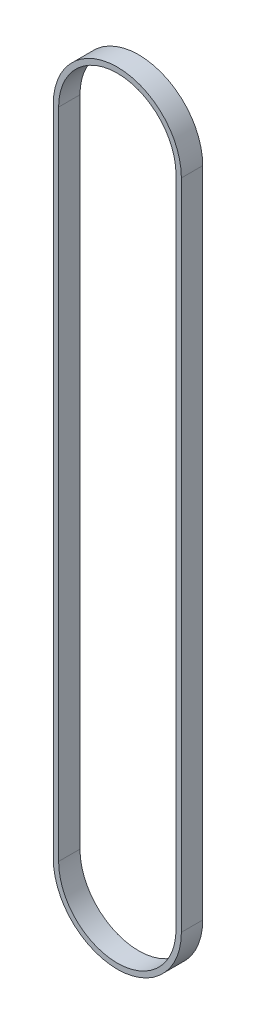
from build123d import *

# Parameters (mm, degrees)
BOSS_EXTRUDE1_DEPTH = 25.4


with BuildPart() as part:
    # Sketch1 → Boss-Extrude1 (new body)
    with BuildSketch(Plane.XY):
        with BuildLine():
            Line((-76.2, -366.489291397), (-76.2, 410.750708603))
            ThreePointArc((-76.2, 410.750708603), (0, 486.950708603), (76.2, 410.750708603))
            Line((76.2, 410.750708603), (76.2, -366.489291397))
            ThreePointArc((76.2, -366.489291397), (0, -442.689291397), (-76.2, -366.489291397))
        make_face()
        with BuildLine():
            Line((-69.85, 410.750708603), (-69.85, -366.489291397))
            ThreePointArc((-69.85, -366.489291397), (0, -436.339291397), (69.85, -366.489291397))
            Line((69.85, -366.489291397), (69.85, 410.750708603))
            ThreePointArc((69.85, 410.750708603), (0, 480.600708603), (-69.85, 410.750708603))
        make_face(mode=Mode.SUBTRACT)
    extrude(amount=BOSS_EXTRUDE1_DEPTH)


solid = part.part
